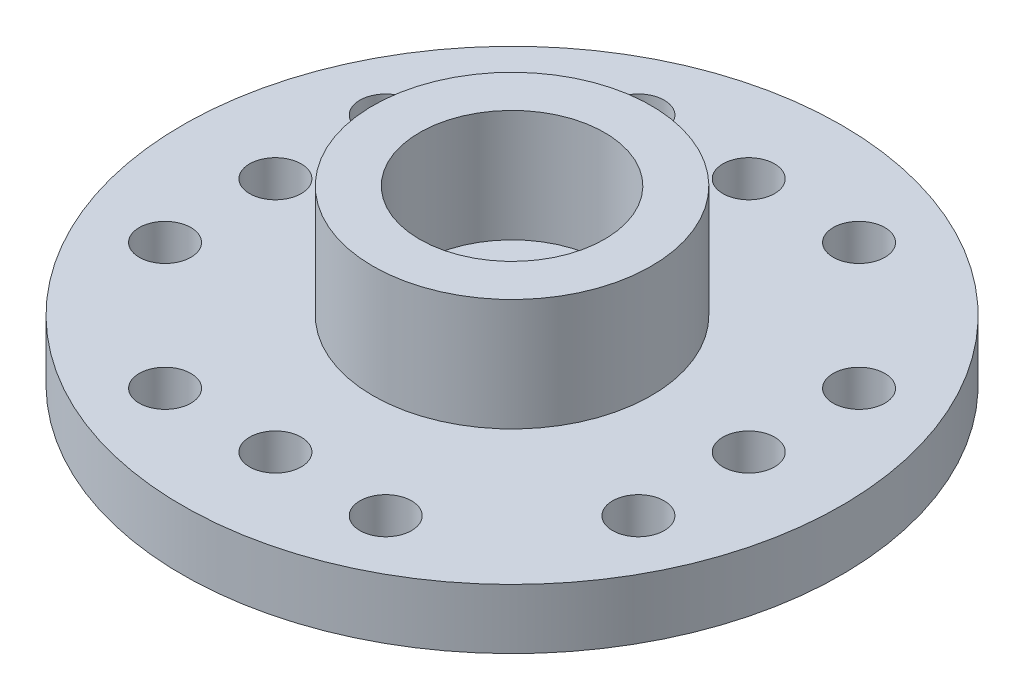
from build123d import *

# Parameters (mm, degrees)
SKETCH1_R           = 10.4521
BOSS_EXTRUDE1_DEPTH = 1.9
SKETCH2_R           = 4.41325
BOSS_EXTRUDE2_DEPTH = 3.556
SKETCH3_R           = 1.49225
SKETCH3_R_2         = 0.81915
CUT_EXTRUDE1_DEPTH  = 16.756291595
SKETCH4_R           = 2.9337
CUT_EXTRUDE2_DEPTH  = 3.556


with BuildPart() as part:
    # Sketch1 → Boss-Extrude1 (new body)
    with BuildSketch(Plane(origin=(0, 0, 0), x_dir=(1, 0, 0), z_dir=(0, 1, 0))):
        with Locations(Location((0, 0, 0), (0, 0, 90))):
            Circle(SKETCH1_R)
    extrude(amount=BOSS_EXTRUDE1_DEPTH)

    # Sketch2 → Boss-Extrude2 (add)
    with BuildSketch(Plane(origin=(0, 1.9, 0), x_dir=(1, 0, 0), z_dir=(0, 1, 0))):
        with Locations(Location((0, 0, 0), (0, 0, 270))):
            Circle(SKETCH2_R)
    extrude(amount=BOSS_EXTRUDE2_DEPTH)

    # Sketch3 → Cut-Extrude1 (cut, through all)
    with BuildSketch(Plane.XZ):
        with Locations(Location((0, 0, 0), (0, 0, 270))):
            Circle(SKETCH3_R)
        with Locations(Location((-7.5057, 0, 0), (0, 0, 270))):
            Circle(SKETCH3_R_2)
        with Locations(Location((-7.5057, 3.49885, 0), (0, 0, 270))):
            Circle(SKETCH3_R_2)
        with Locations(Location((-7.5057, -3.49885, 0), (0, 0, 270))):
            Circle(SKETCH3_R_2)
        with Locations(Location((0, 7.5057, 0), (0, 0, 270))):
            Circle(SKETCH3_R_2)
        with Locations(Location((3.49885, 7.5057, 0), (0, 0, 270))):
            Circle(SKETCH3_R_2)
        with Locations(Location((-3.49885, 7.5057, 0), (0, 0, 270))):
            Circle(SKETCH3_R_2)
        with Locations(Location((7.5057, 0, 0), (0, 0, 270))):
            Circle(SKETCH3_R_2)
        with Locations(Location((7.5057, -3.49885, 0), (0, 0, 270))):
            Circle(SKETCH3_R_2)
        with Locations(Location((7.5057, 3.49885, 0), (0, 0, 270))):
            Circle(SKETCH3_R_2)
        with Locations(Location((0, -7.5057, 0), (0, 0, 270))):
            Circle(SKETCH3_R_2)
        with Locations(Location((-3.49885, -7.5057, 0), (0, 0, 270))):
            Circle(SKETCH3_R_2)
        with Locations(Location((3.49885, -7.5057, 0), (0, 0, 270))):
            Circle(SKETCH3_R_2)
    extrude(amount=-CUT_EXTRUDE1_DEPTH, mode=Mode.SUBTRACT)

    # Sketch4 → Cut-Extrude2 (cut)
    with BuildSketch(Plane(origin=(0, 5.456, 0), x_dir=(1, 0, 0), z_dir=(0, 1, 0))):
        with Locations(Location((0, 0, 0), (0, 0, 270))):
            Circle(SKETCH4_R)
    extrude(amount=-CUT_EXTRUDE2_DEPTH, mode=Mode.SUBTRACT)


solid = part.part
